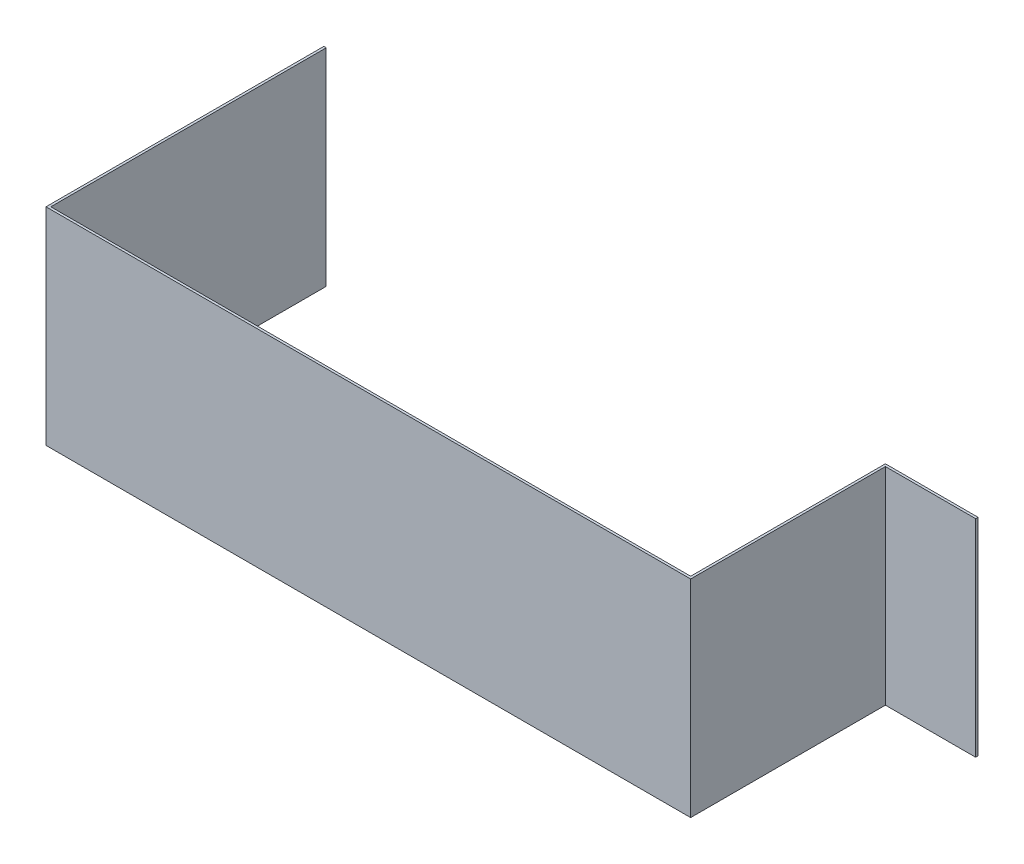
from build123d import *

# Parameters (mm, degrees)
RIBBON_DEPTH = 13


with BuildPart() as part:
    # Sketch1 → Ribbon (new body)
    with BuildSketch(Plane(origin=(0, 3.2, 0), x_dir=(1, 0, 0), z_dir=(0, 1, 0))):
        Polygon((54.525, -4.6), (54.525, -22.075), (95.075, -22.075), (95.075, -9.825), (100.75, -9.825), (100.75, -9.675), (94.925, -9.675), (94.925, -21.925), (54.675, -21.925), (54.675, -4.6), align=None)
    extrude(amount=RIBBON_DEPTH)


solid = part.part
